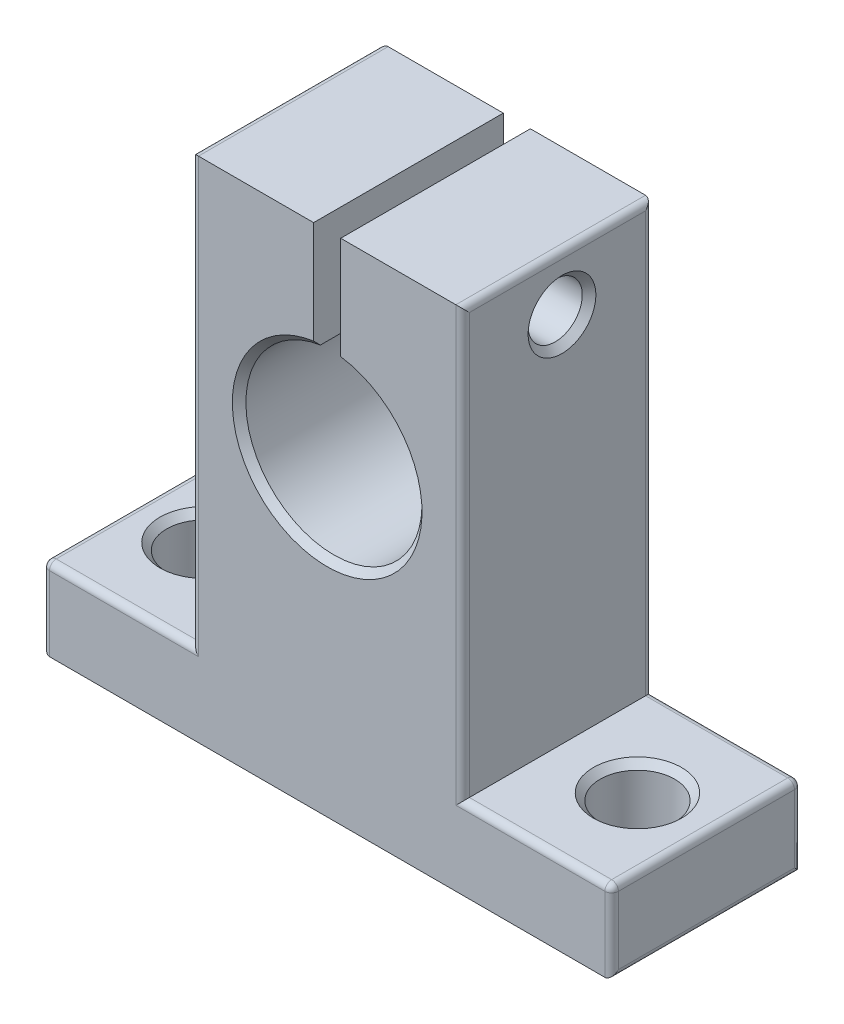
from build123d import *

# Parameters (mm, degrees)
BOSS_EXTRUDE1_DEPTH     = 7
SKETCH2_R               = 2.75
CUT_EXTRUDE1_DEPTH      = 39.5
CUT_EXTRUDE2_DEPTH      = 42.512046444
CUT_EXTRUDE2_DEPTH_BACK = 42.512046444
SKETCH5_R               = 2
CHAMFER2_SIZE           = 0.5
FILLET2_R               = 0.5


with BuildPart() as part:
    # Sketch1 → Boss-Extrude1 (new, symmetric)
    with BuildSketch(Plane.XY):
        with BuildLine():
            Line((-21, -3), (-21, 3))
            Line((-21, 3), (-10, 3))
            Line((-10, 3), (-10, 34.5))
            Line((-10, 34.5), (-1, 34.5))
            Line((-1, 34.5), (-1, 26.422616289))
            ThreePointArc((-1, 26.422616289), (0, 13.5), (1, 26.422616289))
            Line((1, 26.422616289), (1, 34.5))
            Line((1, 34.5), (10, 34.5))
            Line((10, 34.5), (10, 3))
            Line((10, 3), (21, 3))
            Line((21, 3), (21, -3))
            Line((21, -3), (-21, -3))
        make_face()
    extrude(amount=BOSS_EXTRUDE1_DEPTH, both=True)

    # Sketch2 → Cut-Extrude1 (cut, through all)
    with BuildSketch(Plane(origin=(0, 3, 0), x_dir=(1, 0, 0), z_dir=(0, 1, 0))):
        with Locations(Location((15.904501915, 0, 0), (0, 0, 180))):
            Circle(SKETCH2_R)
        with Locations(Location((-16.095498085, 0, 0), (0, 0, 180))):
            Circle(SKETCH2_R)
    extrude(amount=-CUT_EXTRUDE1_DEPTH, mode=Mode.SUBTRACT)

    # Sketch5 → Cut-Extrude2 (cut, two sides: drawn at the far end of the back side and taken through both)
    with BuildSketch(Plane(origin=(-1, 0, 0), x_dir=(0, 0, -1), z_dir=(1, 0, 0)).offset(-CUT_EXTRUDE2_DEPTH_BACK)):
        with Locations((0.330734984, 30.461308145)):
            Circle(SKETCH5_R)
    extrude(amount=CUT_EXTRUDE2_DEPTH + CUT_EXTRUDE2_DEPTH_BACK, mode=Mode.SUBTRACT)

    # Chamfer2
    chamfer2_edges = [part.edges().sort_by_distance(p)[0] for p in [
        (0, 13.5, -7),
        (0, 13.5, 7),
        (18.654501915, 3, 0),
        (-13.345498085, 3, 0),
        (-10, 30.461308145, 1.669265016),
        (10, 30.461308145, 1.669265016),
    ]]
    chamfer(chamfer2_edges, length=CHAMFER2_SIZE)

    # Fillet2
    fillet2_edges = [part.edges().sort_by_distance(p)[0] for p in [
        (-15.5, 3, 7),
        (10, 18.75, -7),
        (15.5, 3, -7),
        (-21, 0, 7),
        (21, 0, -7),
        (-21, 0, -7),
        (-15.5, 3, -7),
        (-10, 18.75, -7),
        (21, 0, 7),
        (10, 34.5, 0),
        (21, 3, 0),
        (21, -3, 0),
        (-21, -3, 0),
        (-21, 3, 0),
        (-10, 34.5, 0),
        (15.5, 3, 7),
        (10, 18.75, 7),
        (-10, 18.75, 7),
    ]]
    fillet(fillet2_edges, radius=FILLET2_R)


solid = part.part
